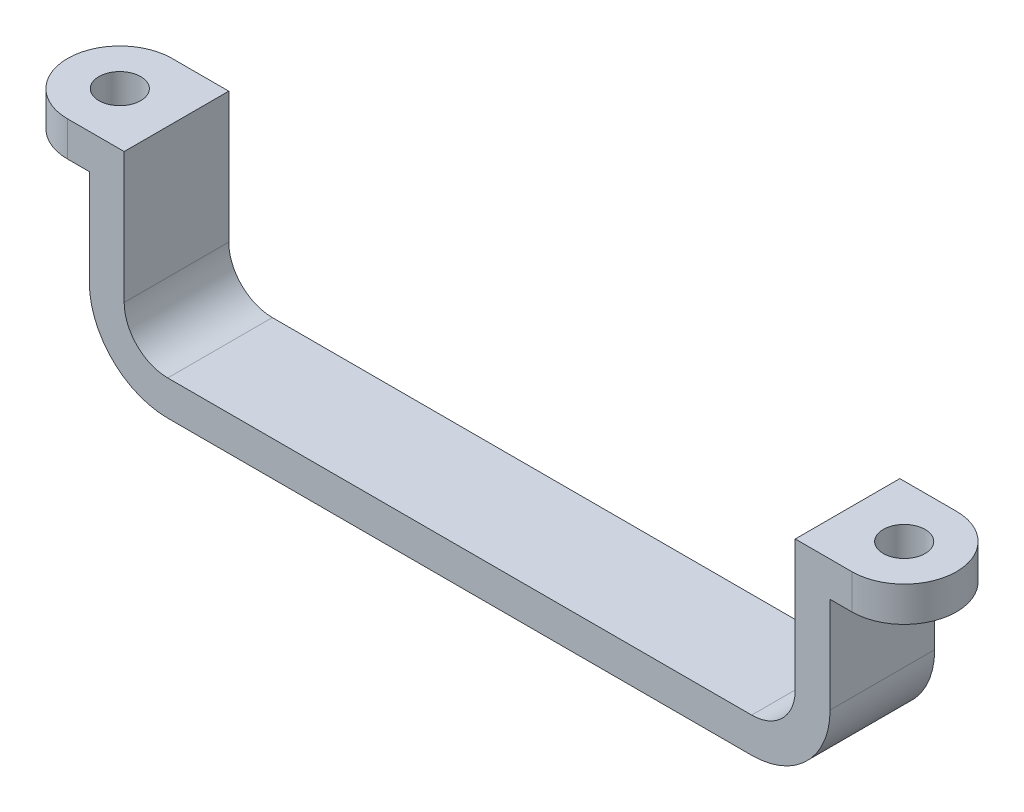
from build123d import *

# Parameters (mm, degrees)
BOSS_EXTRUDE1_DEPTH = 6
SKETCH3_R           = 1.2
BOSS_EXTRUDE6_DEPTH = 2


with BuildPart() as part:
    # Sketch1 → Boss-Extrude1 (new body)
    with BuildSketch(Plane.XY):
        with BuildLine():
            Line((-21.25, 10), (-21.25, 2.5))
            ThreePointArc((-21.25, 2.5), (-19.931980515, -0.681980515), (-16.75, -2))
            Line((-16.75, -2), (16.75, -2))
            ThreePointArc((16.75, -2), (19.931980515, -0.681980515), (21.25, 2.5))
            Line((21.25, 2.5), (21.25, 10))
            Line((21.25, 10), (19.25, 10))
            Line((19.25, 10), (19.25, 2.5))
            ThreePointArc((19.25, 2.5), (18.517766953, 0.732233047), (16.75, 0))
            Line((16.75, 0), (-16.75, 0))
            ThreePointArc((-16.75, 0), (-18.517766953, 0.732233047), (-19.25, 2.5))
            Line((-19.25, 2.5), (-19.25, 10))
            Line((-19.25, 10), (-21.25, 10))
        make_face()
    extrude(amount=BOSS_EXTRUDE1_DEPTH)

    # Sketch3 → Boss-Extrude6 (add)
    # profile 1 of 2: a face of its own
    with BuildSketch(Plane(origin=(0, 10, 0), x_dir=(-1, 0, 0), z_dir=(0, 1, 0))):
        with BuildLine():
            Line((-21.25, 6), (-22.5, 6))
            ThreePointArc((-22.5, 6), (-25.5, 3), (-22.5, 0))
            Line((-22.5, 0), (-21.25, 0))
            Line((-21.25, 0), (-21.25, 6))
        make_face()
        with Locations(Location((-22.5, 3, 0), (0, 0, 90))):
            Circle(SKETCH3_R, mode=Mode.SUBTRACT)
    # profile 2 of 2: a face of its own
    with BuildSketch(Plane(origin=(0, 10, 0), x_dir=(-1, 0, 0), z_dir=(0, 1, 0))):
        with BuildLine():
            Line((22.5, 6), (21.25, 6))
            Line((21.25, 6), (21.25, 0))
            Line((21.25, 0), (22.5, 0))
            ThreePointArc((22.5, 0), (25.5, 3), (22.5, 6))
        make_face()
        with Locations(Location((22.5, 3, 0), (0, 0, 90))):
            Circle(SKETCH3_R, mode=Mode.SUBTRACT)
    extrude(amount=-BOSS_EXTRUDE6_DEPTH)


solid = part.part
